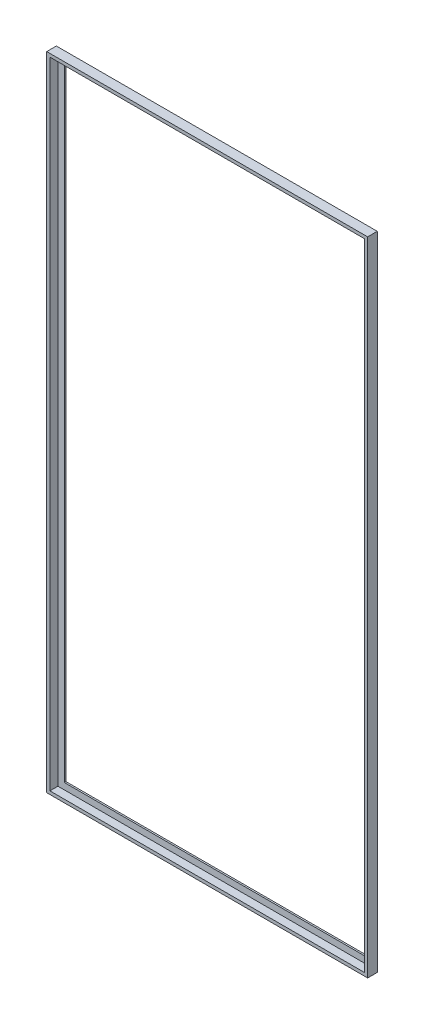
from build123d import *

# Parameters (mm, degrees)
CROQUIS1_W              = 980
CROQUIS1_H              = 1980
CROQUIS1_W_2            = 940
CROQUIS1_H_2            = 1940
SALIENTE_EXTRUIR1_DEPTH = 5
CROQUIS1_4_W            = 1000
CROQUIS1_4_H            = 2000
CROQUIS1_4_W_2          = 980
CROQUIS1_4_H_2          = 1980
SALIENTE_EXTRUIR2_DEPTH = 30


with BuildPart() as part:
    # Croquis1 → Saliente-Extruir1 (new body)
    with BuildSketch(Plane.XY):
        with Locations((500, 1000)):
            Rectangle(CROQUIS1_W, CROQUIS1_H)
        with Locations((500, 1000)):
            Rectangle(CROQUIS1_W_2, CROQUIS1_H_2, mode=Mode.SUBTRACT)
    extrude(amount=SALIENTE_EXTRUIR1_DEPTH)

    # Croquis1<4> → Saliente-Extruir2 (add)
    with BuildSketch(Plane.XY):
        with Locations((500, 1000)):
            Rectangle(CROQUIS1_4_W, CROQUIS1_4_H)
        with Locations((500, 1000)):
            Rectangle(CROQUIS1_4_W_2, CROQUIS1_4_H_2, mode=Mode.SUBTRACT)
    extrude(amount=SALIENTE_EXTRUIR2_DEPTH)


solid = part.part
